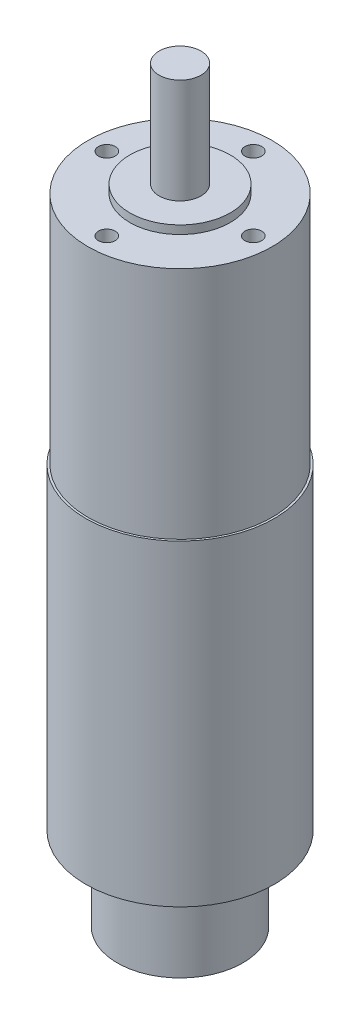
from build123d import *

# Parameters (mm, degrees)
SKETCH1_R           = 22.5
BOSS_EXTRUDE1_DEPTH = 75.7
SKETCH2_R           = 22
BOSS_EXTRUDE3_DEPTH = 56
SKETCH3_R           = 5
BOSS_EXTRUDE4_DEPTH = 27
SKETCH5_R           = 2
CUT_EXTRUDE2_DEPTH  = 9
CIRPATTERN1_COUNT   = 4
SKETCH6_R           = 12
BOSS_EXTRUDE5_DEPTH = 2
SKETCH7_R           = 15
BOSS_EXTRUDE6_DEPTH = 20


with BuildPart() as part:
    # Sketch1 → Boss-Extrude1 (new body)
    with BuildSketch(Plane(origin=(0, 0, 0), x_dir=(1, 0, 0), z_dir=(0, 1, 0))):
        with Locations(Location((0, 0, 0), (0, 0, 270))):
            Circle(SKETCH1_R)
    extrude(amount=BOSS_EXTRUDE1_DEPTH)

    # Sketch2 → Boss-Extrude3 (add)
    with BuildSketch(Plane(origin=(0, 75.7, 0), x_dir=(1, 0, 0), z_dir=(0, 1, 0))):
        with Locations(Location((0, 0, 0), (0, 0, 270))):
            Circle(SKETCH2_R)
    extrude(amount=BOSS_EXTRUDE3_DEPTH)

    # Sketch3 → Boss-Extrude4 (add)
    with BuildSketch(Plane(origin=(0, 131.7, 0), x_dir=(1, 0, 0), z_dir=(0, 1, 0))):
        with Locations(Location((0, 0, 0), (0, 0, 270))):
            Circle(SKETCH3_R)
    extrude(amount=BOSS_EXTRUDE4_DEPTH)

    # Sketch5 → Cut-Extrude2 (cut)
    with BuildSketch(Plane(origin=(0, 131.7, 0), x_dir=(1, 0, 0), z_dir=(0, 1, 0))):
        with Locations(Location((0, 17.5, 0), (0, 0, 270))):
            Circle(SKETCH5_R)
    cut_extrude2 = extrude(amount=-CUT_EXTRUDE2_DEPTH, mode=Mode.SUBTRACT)

    # CirPattern1: Cut-Extrude2 ×4 about axis
    cirpattern1_axis = Axis((0, 0, 0), (0, 1, 0))
    for i in range(1, CIRPATTERN1_COUNT):
        add(cut_extrude2.rotate(cirpattern1_axis, i * 360 / CIRPATTERN1_COUNT), mode=Mode.SUBTRACT)

    # Sketch6 → Boss-Extrude5 (add)
    with BuildSketch(Plane(origin=(0, 131.7, 0), x_dir=(1, 0, 0), z_dir=(0, 1, 0))):
        with Locations(Location((0, 0, 0), (0, 0, 270))):
            Circle(SKETCH6_R)
    extrude(amount=BOSS_EXTRUDE5_DEPTH)

    # Sketch7 → Boss-Extrude6 (add)
    with BuildSketch(Plane.XZ):
        with Locations(Location((0, 0, 0), (0, 0, 270))):
            Circle(SKETCH7_R)
    extrude(amount=BOSS_EXTRUDE6_DEPTH)


solid = part.part
